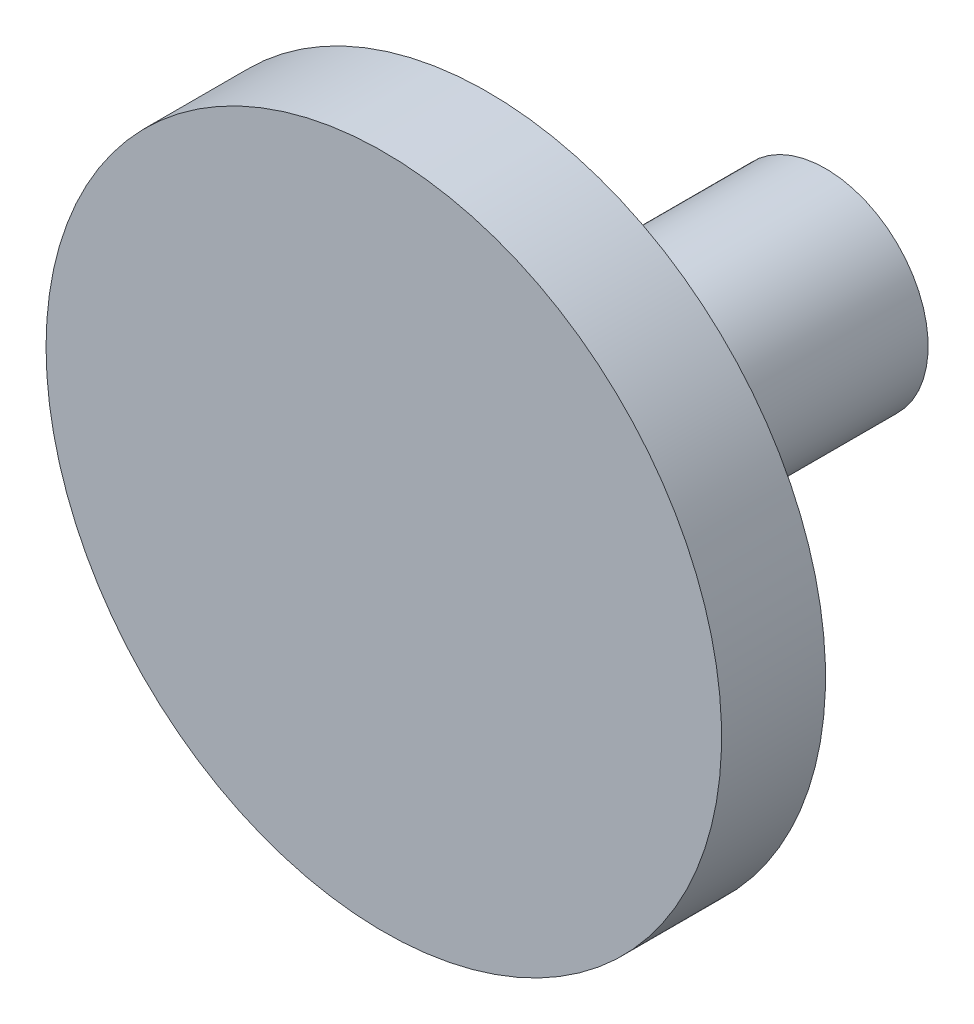
from build123d import *


with BuildPart() as part:
    # Croquis2 → Revolución1 (revolve)
    with BuildSketch(Plane(origin=(0, 0, 0), x_dir=(1, 0, 0), z_dir=(0, 1, 0))):
        Polygon((-13, 0), (-13, 4), (-5.5, 4), (-5.5, 7), (-3.95, 7), (-3.95, 17), (0, 17), (0, 0), align=None)
    revolve(axis=Axis((0, 0, -21.82037769), (0, 0, 1)))


solid = part.part
